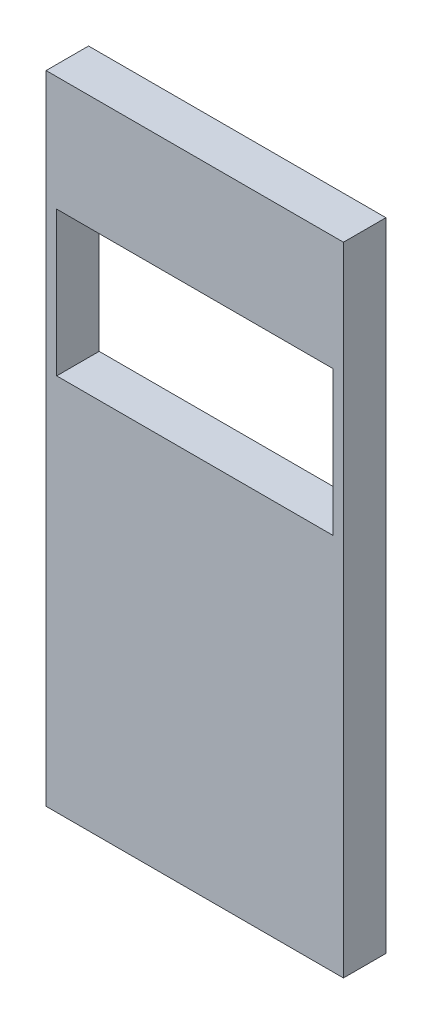
from build123d import *

# Parameters (mm, degrees)
SKETCH1_W           = 70
SKETCH1_H           = 150
BOSS_EXTRUDE1_DEPTH = 10
SKETCH3_W           = 65
SKETCH3_H           = 34
CUT_EXTRUDE1_DEPTH  = 84.366660003


with BuildPart() as part:
    # Sketch1 → Boss-Extrude1 (new body)
    with BuildSketch(Plane.XY):
        Rectangle(SKETCH1_W, SKETCH1_H)
    extrude(amount=BOSS_EXTRUDE1_DEPTH)

    # Sketch3 → Cut-Extrude1 (cut, through all)
    with BuildSketch(Plane(origin=(0, 0, 0), x_dir=(-1, 0, 0), z_dir=(0, 0, -1))):
        with Locations((0, 31)):
            Rectangle(SKETCH3_W, SKETCH3_H)
    extrude(amount=-CUT_EXTRUDE1_DEPTH, mode=Mode.SUBTRACT)


solid = part.part
